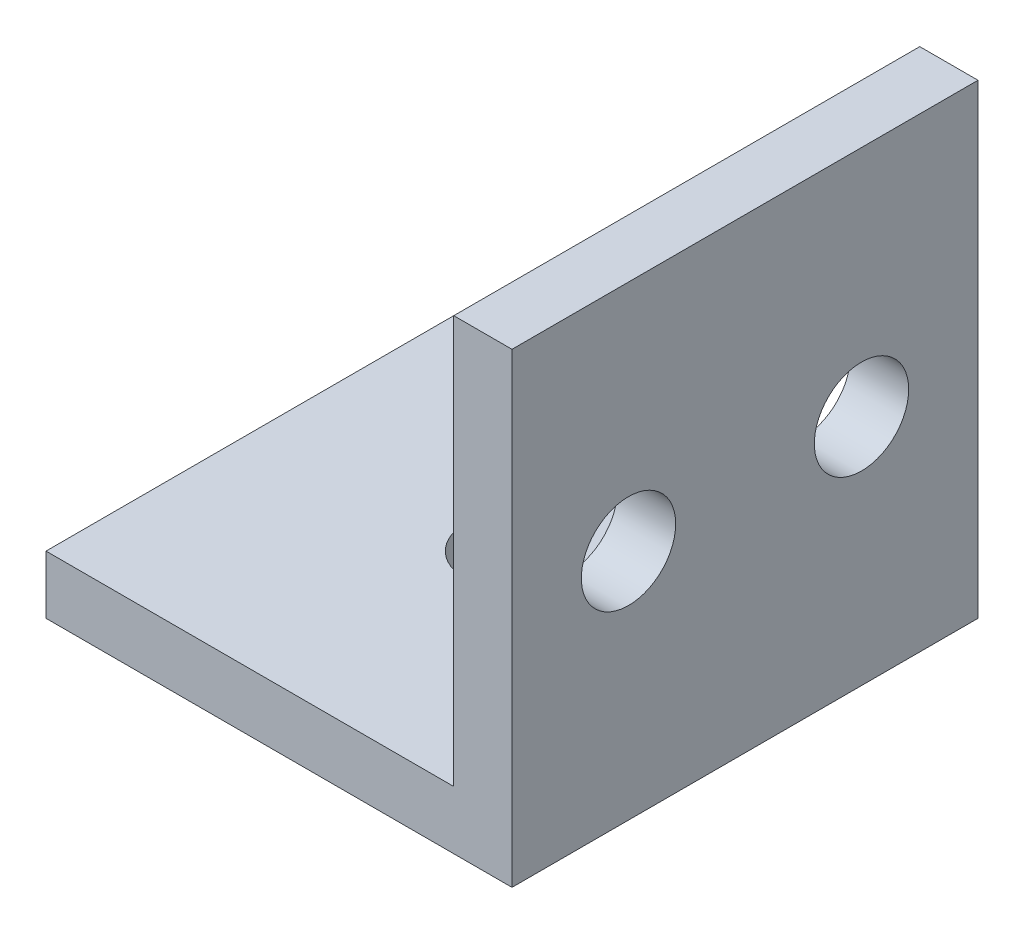
from build123d import *

# Parameters (mm, degrees)
SKETCH_1_W          = 40
SKETCH_1_H          = 40
SKETCH_1_R          = 4.05
EXTRUDE_1_DEPTH     = 5
SKETCH_2_W          = 5
SKETCH_2_H          = 40
EXTRUDE_2_DEPTH     = 35
SKETCH_3_R          = 4.05
CUT_EXTRUDE_1_DEPTH = 35


with BuildPart() as part:
    # 草图1 → 凸台-拉伸1 (new body)
    with BuildSketch(Plane(origin=(0, 0, 0), x_dir=(1, 0, 0), z_dir=(0, 1, 0))):
        Rectangle(SKETCH_1_W, SKETCH_1_H)
        with Locations(Location((0, 0, 0), (0, 0, 270))):
            Circle(SKETCH_1_R, mode=Mode.SUBTRACT)
    extrude(amount=EXTRUDE_1_DEPTH)

    # 草图2 → 凸台-拉伸2 (add)
    with BuildSketch(Plane(origin=(0, 5, 0), x_dir=(1, 0, 0), z_dir=(0, 1, 0))):
        with Locations((17.5, 0)):
            Rectangle(SKETCH_2_W, SKETCH_2_H)
    extrude(amount=EXTRUDE_2_DEPTH)

    # 草图3 → 切除-拉伸1 (cut)
    with BuildSketch(Plane(origin=(20, 0, 0), x_dir=(0, 0, -1), z_dir=(1, 0, 0))):
        with Locations((-10, 20)):
            Circle(SKETCH_3_R)
        with Locations((10, 20)):
            Circle(SKETCH_3_R)
    extrude(amount=-CUT_EXTRUDE_1_DEPTH, mode=Mode.SUBTRACT)


solid = part.part
